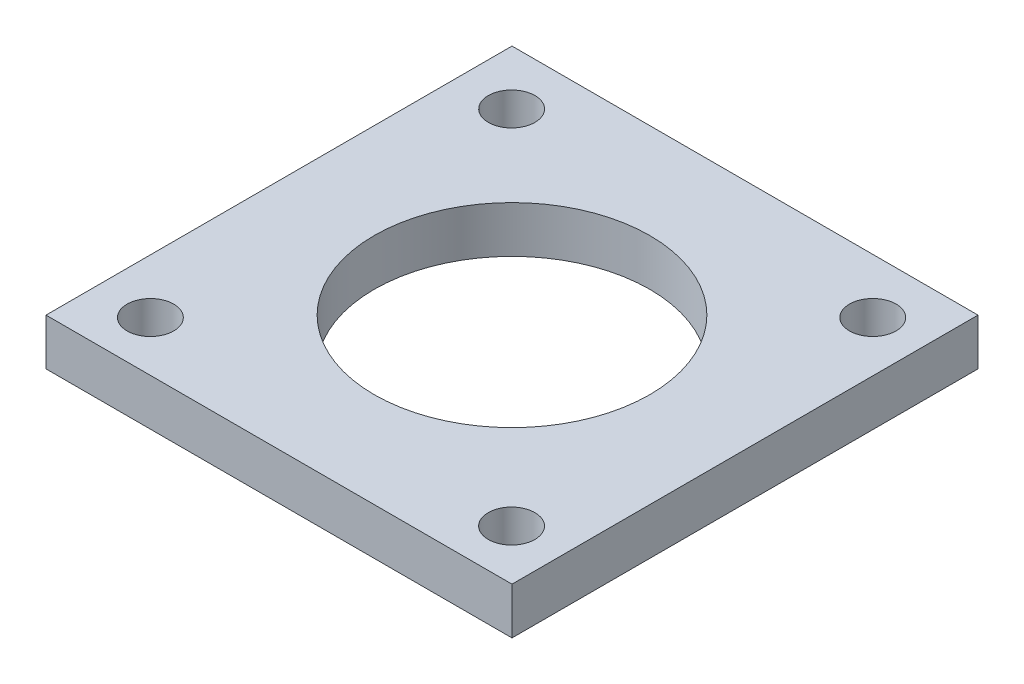
from build123d import *

# Parameters (mm, degrees)
SKETCH1_W           = 40
SKETCH1_H           = 40
SKETCH1_R           = 11.82922145
SKETCH1_R_2         = 1.999999076
BOSS_EXTRUDE1_DEPTH = 4


with BuildPart() as part:
    # Sketch1 → Boss-Extrude1 (new body)
    with BuildSketch(Plane(origin=(0, 0, 0), x_dir=(1, 0, 0), z_dir=(0, 1, 0))):
        with Locations((-0.055147057, 0.947228794)):
            Rectangle(SKETCH1_W, SKETCH1_H)
        with Locations(Location((-0.055147057, 0.947228794, 0), (0, 0, 270))):
            Circle(SKETCH1_R, mode=Mode.SUBTRACT)
        with Locations(Location((-15.393266989, 16.254586215, 0), (0, 0, 270))):
            Circle(SKETCH1_R_2, mode=Mode.SUBTRACT)
        with Locations(Location((15.606731446, 16.254585764, 0), (0, 0, 270))):
            Circle(SKETCH1_R_2, mode=Mode.SUBTRACT)
        with Locations(Location((-15.393268838, -14.752771206, 0), (0, 0, 270))):
            Circle(SKETCH1_R_2, mode=Mode.SUBTRACT)
        with Locations(Location((15.607689771, -14.752898519, 0), (0, 0, 270))):
            Circle(SKETCH1_R_2, mode=Mode.SUBTRACT)
    extrude(amount=BOSS_EXTRUDE1_DEPTH)


solid = part.part
